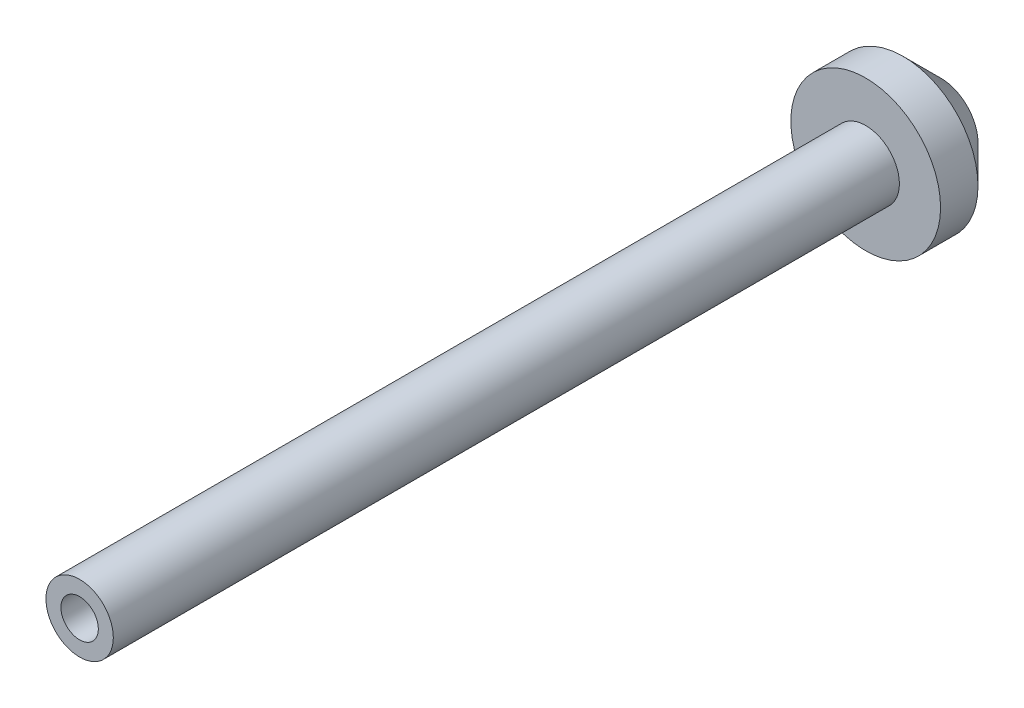
from build123d import *

# Parameters (mm, degrees)
SKETCH1_R           = 5
BOSS_EXTRUDE1_DEPTH = 5
SKETCH2_R           = 2.25
BOSS_EXTRUDE2_DEPTH = 52.5
SKETCH3_R           = 1.25
CUT_EXTRUDE1_DEPTH  = 10
CHAMFER1_SIZE       = 2.5


with BuildPart() as part:
    # Sketch1 → Boss-Extrude1 (new body)
    with BuildSketch(Plane.XY):
        Circle(SKETCH1_R)
    extrude(amount=BOSS_EXTRUDE1_DEPTH)

    # Sketch2 → Boss-Extrude2 (add)
    with BuildSketch(Plane.XY.offset(5)):
        Circle(SKETCH2_R)
    extrude(amount=BOSS_EXTRUDE2_DEPTH)

    # Sketch3 → Cut-Extrude1 (cut)
    with BuildSketch(Plane.XY.offset(57.5)):
        Circle(SKETCH3_R)
    extrude(amount=-CUT_EXTRUDE1_DEPTH, mode=Mode.SUBTRACT)

    # Chamfer1
    chamfer1_edges = [part.edges().sort_by_distance(p)[0] for p in [
        (-5, 0, 0),
    ]]
    chamfer(chamfer1_edges, length=CHAMFER1_SIZE)


solid = part.part
